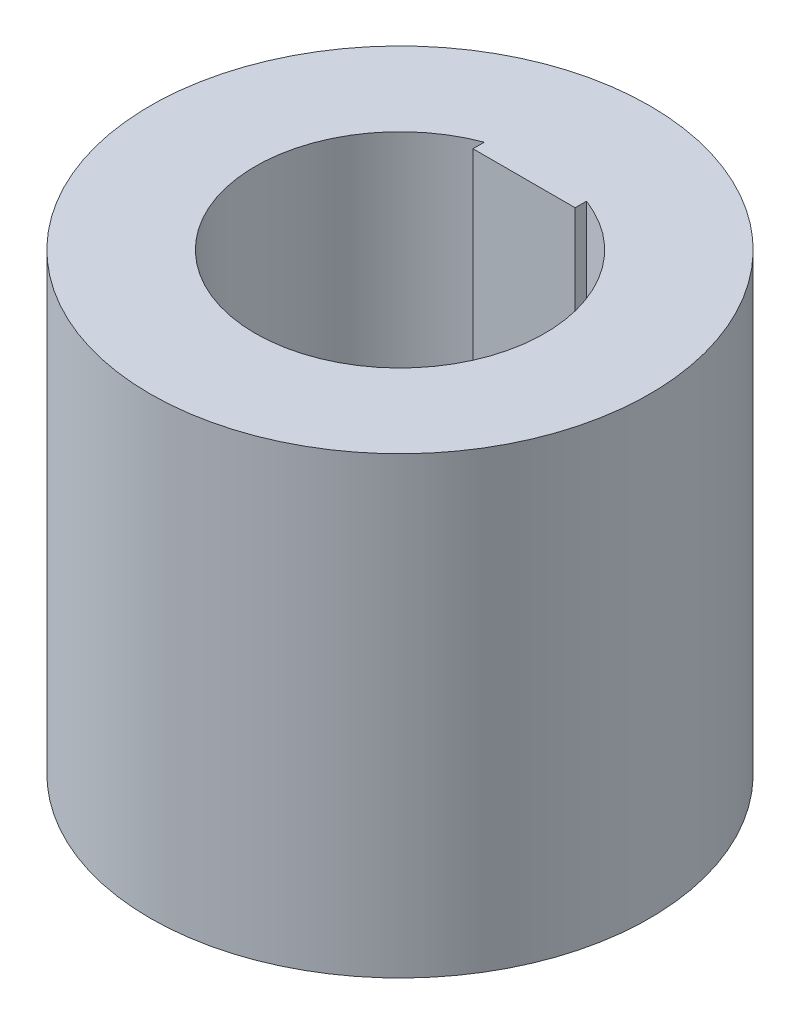
from build123d import *

# Parameters (mm, degrees)
SKETCH1_R           = 4.4
SKETCH1_R_2         = 2.55
SKETCH1_W           = 1.8
SKETCH1_H           = 0.2
BOSS_EXTRUDE1_DEPTH = 4


with BuildPart() as part:
    # Sketch1 → Boss-Extrude1 (new, symmetric)
    # profile 1 of 3: a face of its own
    with BuildSketch(Plane(origin=(0, 0, 0), x_dir=(1, 0, 0), z_dir=(0, 1, 0))):
        with Locations(Location((0, 0, 0), (0, 0, 270))):
            Circle(SKETCH1_R)
        Circle(SKETCH1_R_2, mode=Mode.SUBTRACT)
    # profile 2 of 3: a face of its own
    with BuildSketch(Plane(origin=(0, 0, 0), x_dir=(1, 0, 0), z_dir=(0, 1, 0))):
        with Locations((0, 2.285896058)):
            Rectangle(SKETCH1_W, SKETCH1_H)
    # profile 3 of 3: a face of its own
    with BuildSketch(Plane(origin=(0, 0, 0), x_dir=(1, 0, 0), z_dir=(0, 1, 0))):
        with BuildLine():
            ThreePointArc((0.9, 2.385896058), (0, 2.55), (-0.9, 2.385896058))
            Line((-0.9, 2.385896058), (0.9, 2.385896058))
        make_face()
    extrude(amount=BOSS_EXTRUDE1_DEPTH, both=True)


solid = part.part
